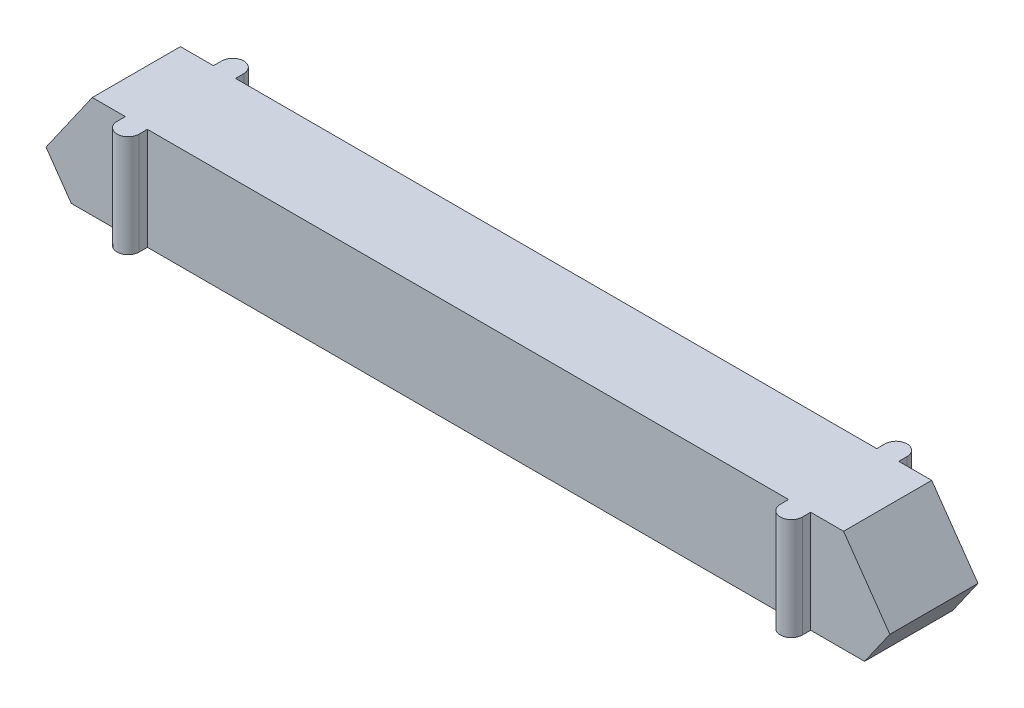
from build123d import *

# Parameters (mm, degrees)
BOSS_EXTRUDE3_DEPTH                      = 50.8
BOSS_EXTRUDE4_DEPTH                      = 58.906461925
MIRROR1_AT_THE_SECOND_PLANE_COPY_1_DEPTH = 58.906461925


with BuildPart() as part:
    # Sketch3 → Boss-Extrude3 (new body)
    with BuildSketch(Plane.XY):
        Polygon((0, 0), (14.568841483, -20.806461925), (471.768841483, -20.806461925), (486.337682967, 0), (459.659775761, 38.1), (26.677907206, 38.1), align=None)
    extrude(amount=BOSS_EXTRUDE3_DEPTH)

    # Sketch4 → Boss-Extrude4 (add)
    with BuildSketch(Plane(origin=(0, 38.1, 0), x_dir=(1, 0, 0), z_dir=(0, 1, 0))):
        with BuildLine():
            Line((45.727907206, -55.5625), (45.727907206, -50.8))
            Line((45.727907206, -50.8), (58.427907206, -50.8))
            Line((58.427907206, -50.8), (58.427907206, -55.5625))
            ThreePointArc((58.427907206, -55.5625), (52.077907206, -61.9125), (45.727907206, -55.5625))
        make_face()
    boss_extrude4 = extrude(amount=-BOSS_EXTRUDE4_DEPTH)

    # Mirror1: Boss-Extrude4 across plane
    add(boss_extrude4.mirror(Plane(origin=(243.205, 0, 0), x_dir=(0, 0, 1), z_dir=(1, 0, 0))))

    # Mirror1 at the second plane: Boss-Extrude4 across plane
    add(boss_extrude4.mirror(Plane.XY.offset(25.4)))

    # Mirror1 at the second plane copy 1 sketc → Mirror1 at the second plane copy 1 (add)
    with BuildSketch(Plane(origin=(486.41, 38.1, 50.8), x_dir=(-1, 0, 0), z_dir=(0, 1, 0))):
        with BuildLine():
            Line((45.727907206, -55.5625), (45.727907206, -50.8))
            Line((45.727907206, -50.8), (58.427907206, -50.8))
            Line((58.427907206, -50.8), (58.427907206, -55.5625))
            ThreePointArc((58.427907206, -55.5625), (52.077907206, -61.9125), (45.727907206, -55.5625))
        make_face()
    extrude(amount=-MIRROR1_AT_THE_SECOND_PLANE_COPY_1_DEPTH)


solid = part.part
